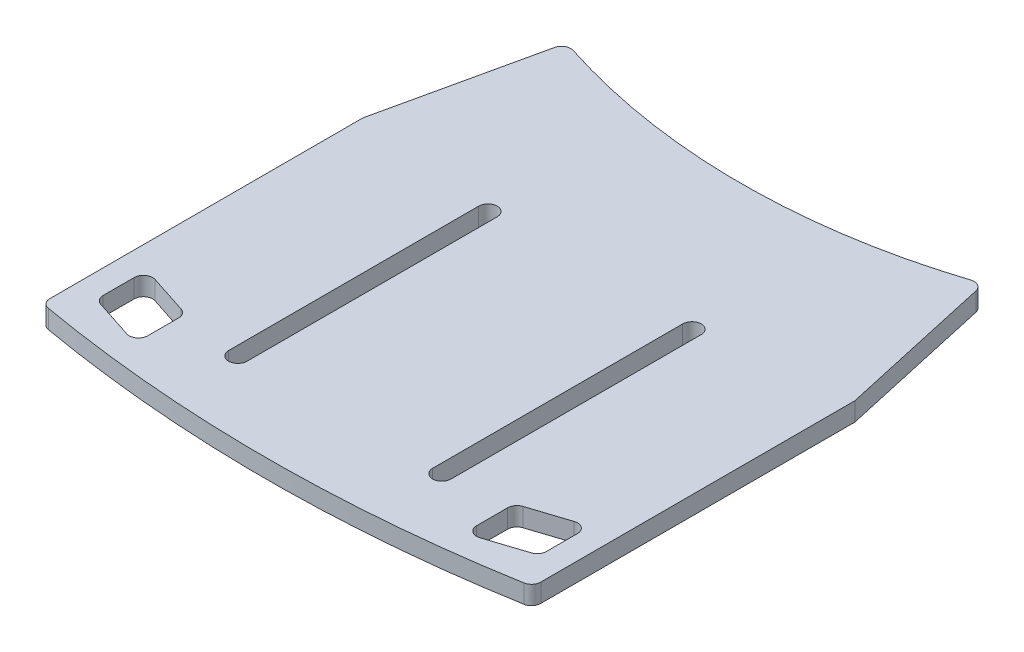
from build123d import *

# Parameters (mm, degrees)
RESSALTO_EXTRUS_O1_DEPTH = 2


with BuildPart() as part:
    # Esboço1 → Ressalto-extrusão1 (new body)
    with BuildSketch(Plane(origin=(0, 0, 0), x_dir=(1, 0, 0), z_dir=(0, 1, 0))):
        with BuildLine():
            Line((-22.739996026, 26.420017885), (-26.47618706, 9.607158229))
            ThreePointArc((-26.47618706, 9.607158229), (-26.494028938, 9.499344543), (-26.5, 9.390227771))
            Line((-26.5, 9.390227771), (-26.5, -24.299313819))
            ThreePointArc((-26.5, -24.299313819), (-26.265286485, -24.943003648), (-25.671326807, -25.284528072))
            ThreePointArc((-25.671326807, -25.284528072), (0, -27.5), (25.671326807, -25.284528072))
            ThreePointArc((25.671326807, -25.284528072), (26.265286485, -24.943003648), (26.5, -24.299313819))
            Line((26.5, -24.299313819), (26.5, 9.607158229))
            Line((26.5, 9.607158229), (22.763808965, 26.420017885))
            ThreePointArc((22.763808965, 26.420017885), (22.284676967, 27.070806428), (21.480921688, 27.154893592))
            ThreePointArc((21.480921688, 27.154893592), (10.878133716, 24.629860221), (0.01190647, 23.781325176))
            ThreePointArc((0.01190647, 23.781325176), (-10.854320777, 24.629860221), (-21.457108748, 27.154893592))
            ThreePointArc((-21.457108748, 27.154893592), (-22.260864027, 27.070806428), (-22.739996026, 26.420017885))
        make_face()
        with BuildLine():
            Line((23.945153985, -17.77729625), (23.945153985, -21.127458538))
            ThreePointArc((23.945153985, -21.127458538), (23.754375079, -21.714962769), (23.254831543, -22.07830017))
            Line((23.254831543, -22.07830017), (19.076176544, -23.439237296))
            ThreePointArc((19.076176544, -23.439237296), (18.178994755, -23.297616757), (17.766498985, -22.488395663))
            Line((17.766498985, -22.488395663), (17.766498985, -19.138233375))
            ThreePointArc((17.766498985, -19.138233375), (17.957277891, -18.550729144), (18.456821427, -18.187391742))
            Line((18.456821427, -18.187391742), (22.635476426, -16.826454617))
            ThreePointArc((22.635476426, -16.826454617), (23.532658215, -16.968075156), (23.945153985, -17.77729625))
        make_face(mode=Mode.SUBTRACT)
        with BuildLine():
            Line((-10, 7.500138791), (-10, -19.499861209))
            ThreePointArc((-10, -19.499861209), (-11, -20.499861209), (-12, -19.499861209))
            Line((-12, -19.499861209), (-12, 7.500138791))
            ThreePointArc((-12, 7.500138791), (-11, 8.500138791), (-10, 7.500138791))
        make_face(mode=Mode.SUBTRACT)
        with BuildLine():
            Line((-23.231018603, -22.07830017), (-19.052363604, -23.439237296))
            ThreePointArc((-19.052363604, -23.439237296), (-18.155181815, -23.297616757), (-17.742686046, -22.488395663))
            Line((-17.742686046, -22.488395663), (-17.742686046, -19.138233375))
            ThreePointArc((-17.742686046, -19.138233375), (-17.933464951, -18.550729144), (-18.433008487, -18.187391742))
            Line((-18.433008487, -18.187391742), (-22.611663487, -16.826454617))
            ThreePointArc((-22.611663487, -16.826454617), (-23.508845275, -16.968075156), (-23.921341045, -17.77729625))
            Line((-23.921341045, -17.77729625), (-23.921341045, -21.127458538))
            ThreePointArc((-23.921341045, -21.127458538), (-23.730562139, -21.714962769), (-23.231018603, -22.07830017))
        make_face(mode=Mode.SUBTRACT)
        with BuildLine():
            Line((10.02381294, 7.500138791), (10.02381294, -19.499861209))
            ThreePointArc((10.02381294, -19.499861209), (11.02381294, -20.499861209), (12.02381294, -19.499861209))
            Line((12.02381294, -19.499861209), (12.02381294, 7.500138791))
            ThreePointArc((12.02381294, 7.500138791), (11.02381294, 8.500138791), (10.02381294, 7.500138791))
        make_face(mode=Mode.SUBTRACT)
    extrude(amount=RESSALTO_EXTRUS_O1_DEPTH)


solid = part.part
